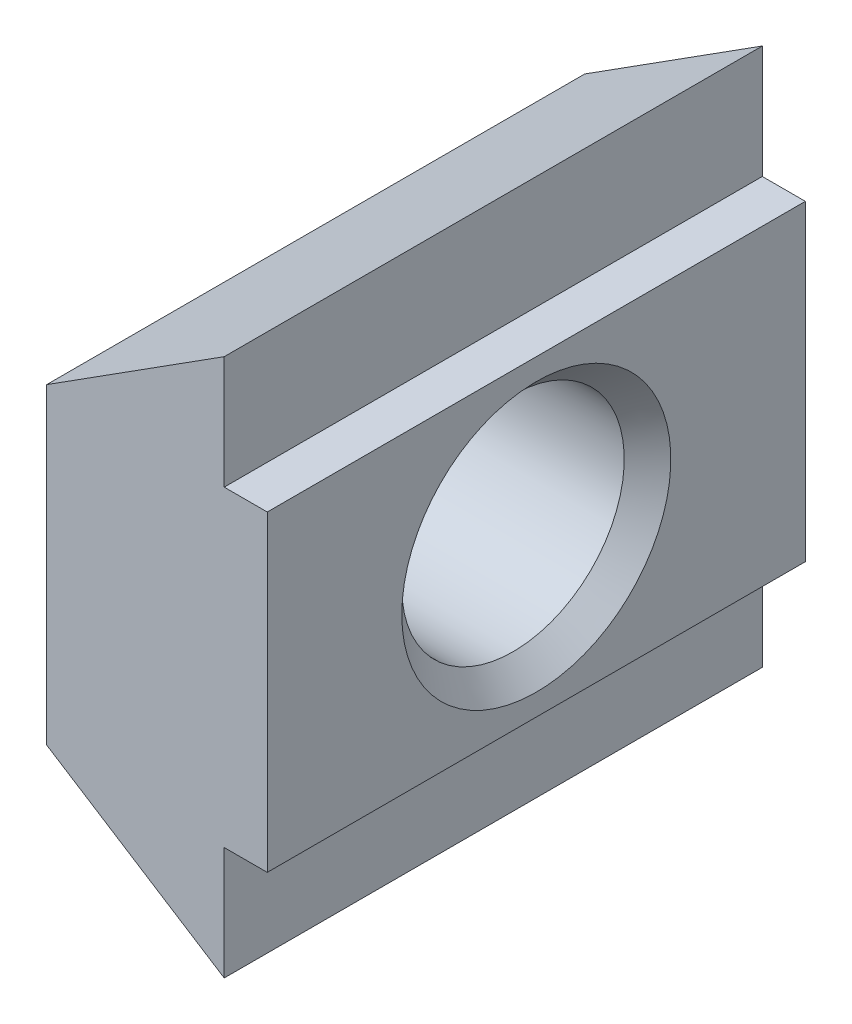
from build123d import *

# Parameters (mm, degrees)
EXTRUDE_1_DEPTH      = 5
EXTRUDE_1_DEPTH_BACK = 5


with BuildPart() as part:
    # 草图1 → 凸台-拉伸1 (new, two sides: drawn at the far end of the back side and taken through both)
    with BuildSketch(Plane.XY.offset(-EXTRUDE_1_DEPTH_BACK)):
        Polygon((-4.1, -2.9), (-0.8, -5), (-0.8, -2.9), (0, -2.9), (0, 2.9), (-0.8, 2.9), (-0.8, 5), (-4.1, 2.9), align=None)
    extrude(amount=EXTRUDE_1_DEPTH + EXTRUDE_1_DEPTH_BACK)

    # 草图2 → 切除-旋转1 (revolve, cut)
    with BuildSketch(Plane.XY):
        Polygon((-4.1, 0), (-4.1, 2.5), (-3.667, 2.067), (-0.433, 2.067), (0, 2.5), (0, 0), align=None)
    revolve(axis=Axis((0, 0, 0), (-1, 0, 0)), mode=Mode.SUBTRACT)


solid = part.part
